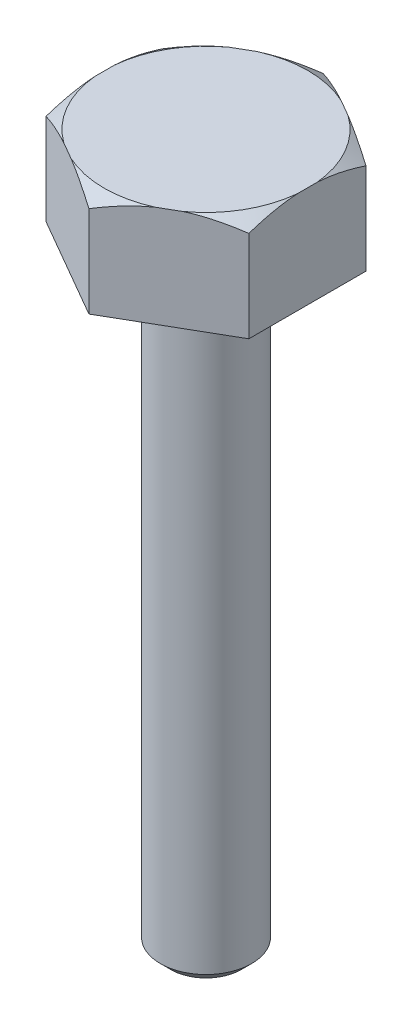
from build123d import *

# Parameters (mm, degrees)
BOSS_EXTRUDE1_DEPTH = 10
SKETCH3_R           = 4.5
BOSS_EXTRUDE2_DEPTH = 60
CHAMFER1_SIZE       = 1


with BuildPart() as part:
    # Sketch1 → Boss-Extrude1 (new body)
    with BuildSketch(Plane(origin=(0, 0, 0), x_dir=(1, 0, 0), z_dir=(0, 1, 0))):
        Polygon((10, 5.773502692), (0, 11.547005384), (-10, 5.773502692), (-10, -5.773502692), (0, -11.547005384), (10, -5.773502692), align=None)
    extrude(amount=BOSS_EXTRUDE1_DEPTH)

    # Sketch2 → Cut-Revolve1 (revolve, cut)
    with BuildSketch(Plane(origin=(0, 0, 0), x_dir=(0, 0, -1), z_dir=(1, 0, 0))):
        Polygon((-11.547005384, 10), (-10.047005384, 10), (-11.547005384, 9), align=None)
    revolve(axis=Axis((0, 0, 0), (0, 1, 0)), mode=Mode.SUBTRACT)

    # Sketch3 → Boss-Extrude2 (add)
    with BuildSketch(Plane.XZ):
        Circle(SKETCH3_R)
    extrude(amount=BOSS_EXTRUDE2_DEPTH)

    # Chamfer1
    chamfer1_edges = [part.edges().sort_by_distance(p)[0] for p in [
        (-4.5, -60, 0),
    ]]
    chamfer(chamfer1_edges, length=CHAMFER1_SIZE)


solid = part.part
